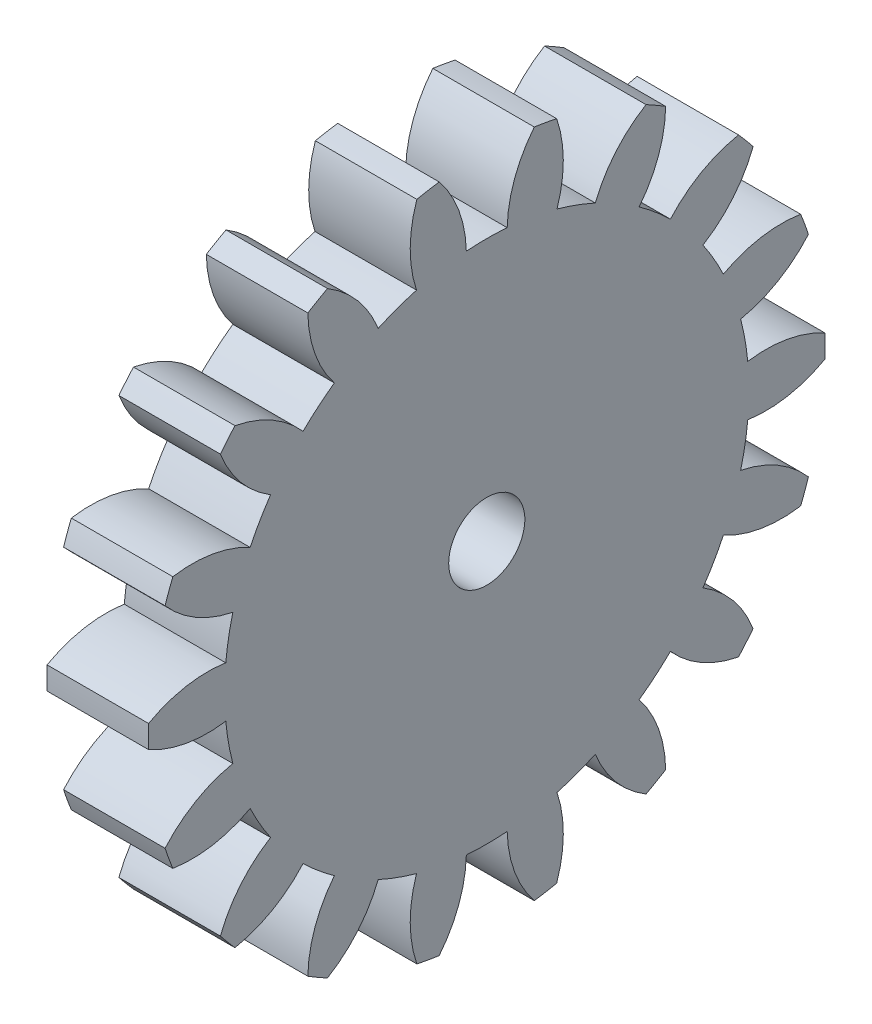
from build123d import *

# Parameters (mm, degrees)
BASPROSKE_W      = 6.35
BASPROSKE_H      = 21.166666667
TOOTHCUT_DEPTH   = 31.600295024
TEETHCUTS_COUNT  = 18
TEETHCUTS_ANGLE  = 340
HUBNEAONESKE_R   = 6.35
HUBNEARONE_DEPTH = 6.3500508
BORSKE_R         = 2.38125
BORE_DEPTH       = 12.7000508


with BuildPart() as part:
    # BasProSke → Base-Revolve (revolve)
    with BuildSketch(Plane(origin=(0, 0, 0), x_dir=(1, 0, 0), z_dir=(0, 1, 0)), mode=Mode.PRIVATE) as base_revolve_sk:
        with Locations((3.175, 10.583333334)):
            Rectangle(BASPROSKE_W, BASPROSKE_H)
    revolve(base_revolve_sk.sketch.rotate(Axis((-10, 0, 0), (1, 0, 0)), 180), axis=Axis((-10, 0, 0), (1, 0, 0)))

    # TooCutSke → ToothCut (cut, through all)
    with BuildSketch(Plane(origin=(0, 0, 0), x_dir=(0, 0, -1), z_dir=(1, 0, 0))):
        with BuildLine():
            ThreePointArc((1.276335511, 16.353164425), (0, 16.402896667), (-1.276335511, 16.353164425))
            ThreePointArc((-1.276335511, 16.353164425), (-1.750239927, 18.809233834), (-2.993916405, 20.979517491))
            ThreePointArc((-2.993916405, 20.979517491), (0, 21.192066667), (2.993916405, 20.979517491))
            ThreePointArc((2.993916405, 20.979517491), (1.750239927, 18.809233834), (1.276335511, 16.353164425))
        make_face()
    toothcut = extrude(amount=TOOTHCUT_DEPTH, mode=Mode.SUBTRACT)

    # TeethCuts: ToothCut ×18 about axis
    teethcuts_axis = Axis((-10, 0, 0), (1, 0, 0))
    for i in range(1, TEETHCUTS_COUNT):
        add(toothcut.rotate(teethcuts_axis, i * TEETHCUTS_ANGLE / (TEETHCUTS_COUNT - 1)), mode=Mode.SUBTRACT)

    # HubNeaOneSke → HubNearOne (add)
    with BuildSketch(Plane.ZY):
        with Locations(Location((0, 0, 0), (0, 0, 180))):
            Circle(HUBNEAONESKE_R)
    extrude(amount=HUBNEARONE_DEPTH)

    # BorSke → Bore (cut, symmetric)
    with BuildSketch(Plane(origin=(0, 0, 0), x_dir=(0, 0, -1), z_dir=(1, 0, 0))):
        with Locations(Location((0, 0, 0), (0, 0, 180))):
            Circle(BORSKE_R)
    extrude(amount=BORE_DEPTH, both=True, mode=Mode.SUBTRACT)


solid = part.part
